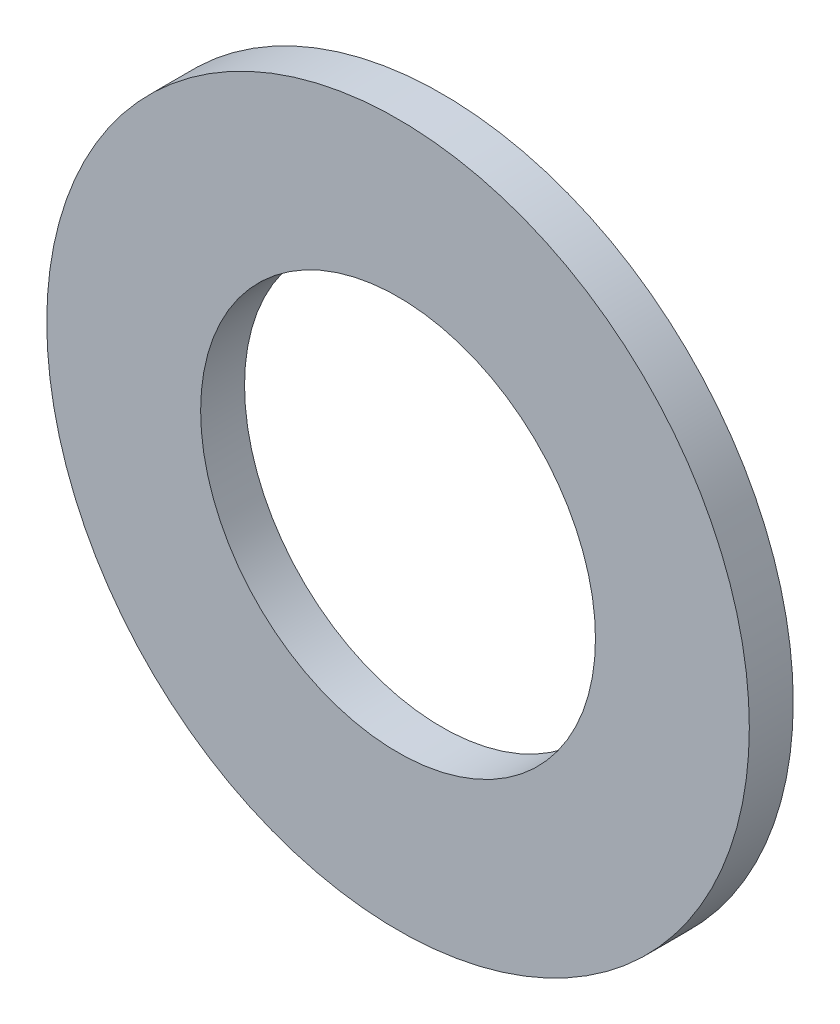
from build123d import *

# Parameters (mm, degrees)
BOSS_EXTRUDE1_DEPTH      = 0.79375
BOSS_EXTRUDE1_DEPTH_BACK = 0.79375
SKETCH3_R                = 12.7
SKETCH3_R_2              = 7.1374


with BuildPart() as part:
    # Sketch3 → Boss-Extrude1 (new, two sides: drawn at the far end of the back side and taken through both)
    with BuildSketch(Plane.XY.offset(-BOSS_EXTRUDE1_DEPTH_BACK)):
        Circle(SKETCH3_R)
        Circle(SKETCH3_R_2, mode=Mode.SUBTRACT)
    extrude(amount=BOSS_EXTRUDE1_DEPTH + BOSS_EXTRUDE1_DEPTH_BACK)


solid = part.part
